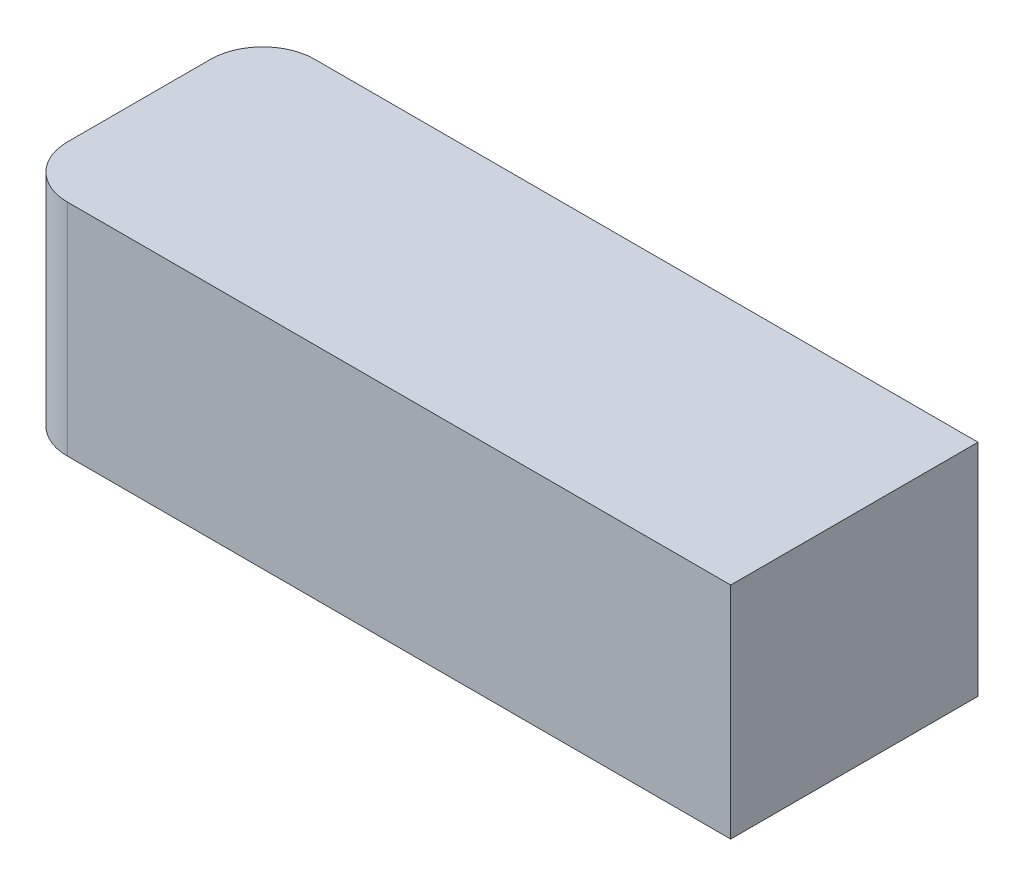
from build123d import *

# Parameters (mm, degrees)
SKETCH1_W           = 137.28
SKETCH1_H           = 42.23
BOSS_EXTRUDE1_DEPTH = 47.46
FILLET1_R           = 10


with BuildPart() as part:
    # Sketch1 → Boss-Extrude1 (new body)
    with BuildSketch(Plane.XY):
        with Locations((68.64, 21.115)):
            Rectangle(SKETCH1_W, SKETCH1_H)
    extrude(amount=BOSS_EXTRUDE1_DEPTH)

    # Fillet1
    fillet1_edges = [part.edges().sort_by_distance(p)[0] for p in [
        (0, 21.115, 47.46),
        (0, 21.115, 0),
    ]]
    fillet(fillet1_edges, radius=FILLET1_R)


solid = part.part
